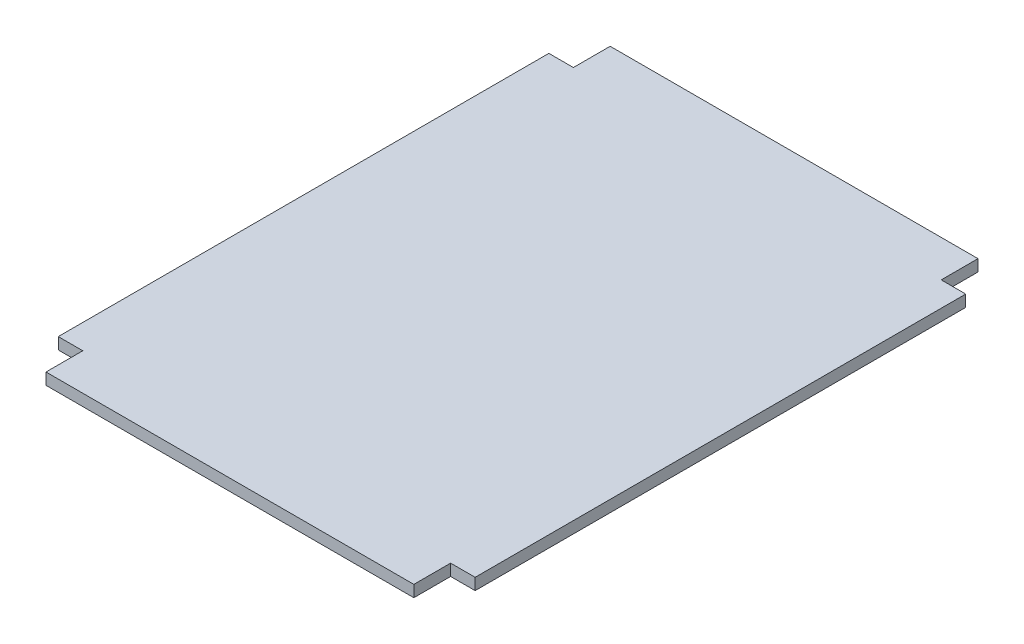
from build123d import *

# Parameters (mm, degrees)
BOSS_EXTRUDE1_DEPTH = 2.9972


with BuildPart() as part:
    # Sketch1 → Boss-Extrude1 (new body)
    with BuildSketch(Plane(origin=(0, 0, 0), x_dir=(1, 0, 0), z_dir=(0, 1, 0))):
        Polygon((-47.6123, -73.025), (47.6123, -73.025), (47.6123, -63.5), (53.9623, -63.5), (53.9623, 63.5), (47.6123, 63.5), (47.6123, 73.025), (-47.6123, 73.025), (-47.6123, 63.5), (-53.9623, 63.5), (-53.9623, -63.5), (-47.6123, -63.5), align=None)
    extrude(amount=BOSS_EXTRUDE1_DEPTH)


solid = part.part
